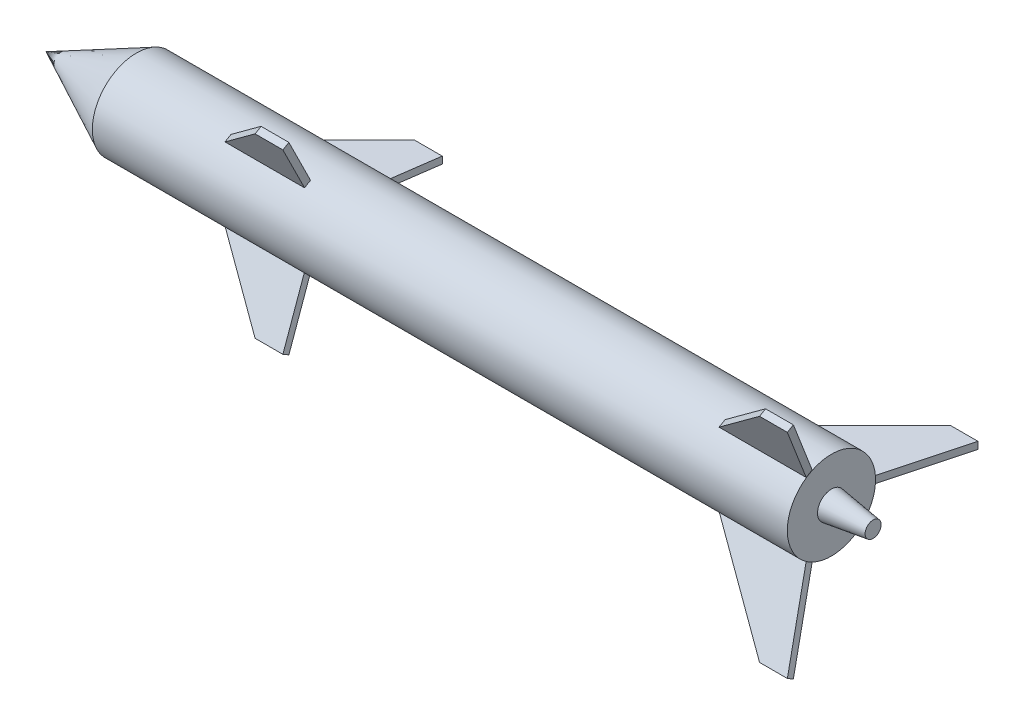
from build123d import *

# Parameters (mm, degrees)
RESSALTO_EXTRUS_O2_DEPTH = 1
RESSALTO_EXTRUS_O3_DEPTH = 1
PADR_OCIRCULAR2_COUNT    = 3
ESBO_O4_R                = 4
RESSALTO_EXTRUS_O4_DEPTH = 12
RESSALTO_EXTRUS_O4_TAPER = 8


with BuildPart() as part:
    # Esboço1 → Revolução1 (revolve)
    with BuildSketch(Plane.XY, mode=Mode.PRIVATE) as revolu_o1_sk:
        Polygon((0, 0), (26.038858788, 12.7), (226.038858788, 12.7), (226.038858788, 0), align=None)
    revolve(revolu_o1_sk.sketch.rotate(Axis((-90.349509161, 0, 0), (1, 0, 0)), 270), axis=Axis((-90.349509161, 0, 0), (1, 0, 0)))

    # Esboço3 → Ressalto-extrusão2 (add, symmetric)
    with BuildSketch(Plane(origin=(0, 0, 0), x_dir=(1, 0, 0), z_dir=(0, 1, 0))):
        Polygon((222.578858788, 0), (232.225029716, 36), (224.225029716, 36), (188.225029716, 0), align=None)
    ressalto_extrus_o2 = extrude(amount=RESSALTO_EXTRUS_O2_DEPTH, both=True)

    # Esboço2 → Ressalto-extrusão3 (add, symmetric)
    with BuildSketch(Plane(origin=(0, 0, 0), x_dir=(1, 0, 0), z_dir=(0, 1, 0))):
        Polygon((76.038858788, 30), (84.038858788, 30), (79.822633747, 0), (46.038858788, 0), align=None)
    ressalto_extrus_o3 = extrude(amount=RESSALTO_EXTRUS_O3_DEPTH, both=True)

    # PadrãoCircular2: Ressalto-extrusão2, Ressalto-extrusão3 ×3 about axis
    padr_ocircular2_axis = Axis((0, 0, 0), (1, 0, 0))
    add([ressalto_extrus_o2.rotate(padr_ocircular2_axis, i * 360 / PADR_OCIRCULAR2_COUNT) for i in range(1, PADR_OCIRCULAR2_COUNT)])
    add([ressalto_extrus_o3.rotate(padr_ocircular2_axis, i * 360 / PADR_OCIRCULAR2_COUNT) for i in range(1, PADR_OCIRCULAR2_COUNT)])

    # Esboço4 → Ressalto-extrusão4 (add)
    with BuildSketch(Plane(origin=(226.038858788, 0, 0), x_dir=(0, 0, -1), z_dir=(1, 0, 0))):
        Circle(ESBO_O4_R)
    extrude(amount=RESSALTO_EXTRUS_O4_DEPTH, taper=RESSALTO_EXTRUS_O4_TAPER)


solid = part.part
